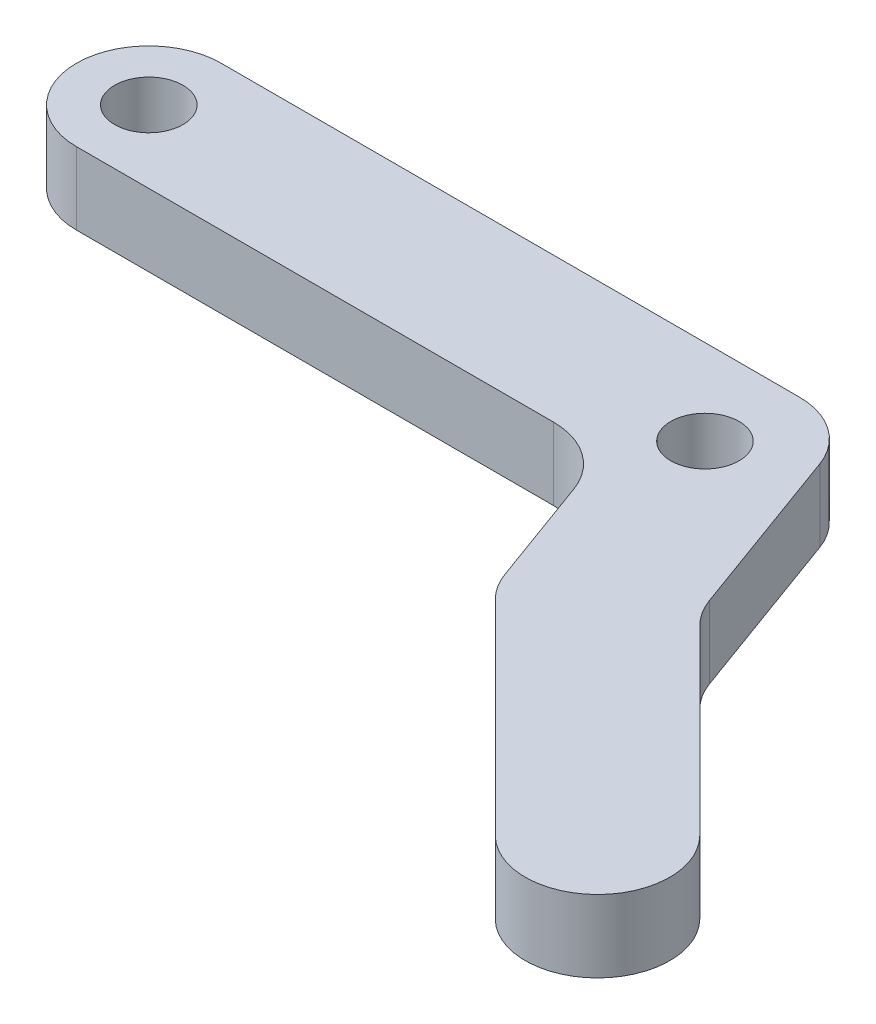
from build123d import *

# Parameters (mm, degrees)
SKETCH1_R           = 1.5
BOSS_EXTRUDE1_DEPTH = 3.175


with BuildPart() as part:
    # Sketch1 → Boss-Extrude1 (new body)
    with BuildSketch(Plane(origin=(0, 0, 0), x_dir=(1, 0, 0), z_dir=(0, 1, 0))):
        with BuildLine():
            Line((0, -3.175), (20.953682132, -3.175))
            ThreePointArc((20.953682132, -3.175), (22.774787318, -3.749192259), (23.937206203, -5.264086045))
            Line((23.937206203, -5.264086045), (25.674217794, -10.036486168))
            ThreePointArc((25.674217794, -10.036486168), (25.979974025, -10.656498469), (26.412677835, -11.195636243))
            Line((26.412677835, -11.195636243), (35.392933956, -20.175892364))
            ThreePointArc((35.392933956, -20.175892364), (39.883062017, -20.175892364), (39.883062017, -15.685764304))
            Line((39.883062017, -15.685764304), (31.898243321, -7.700945608))
            ThreePointArc((31.898243321, -7.700945608), (31.465539511, -7.161807835), (31.15978328, -6.541795533))
            Line((31.15978328, -6.541795533), (28.383524071, 1.085913955))
            ThreePointArc((28.383524071, 1.085913955), (27.221105185, 2.600807741), (25.4, 3.175))
            Line((25.4, 3.175), (0, 3.175))
            ThreePointArc((0, 3.175), (-3.175, 0), (0, -3.175))
        make_face()
        with Locations(Location((24.997946252, -0.574192259, 0), (0, 0, 270))):
            Circle(SKETCH1_R, mode=Mode.SUBTRACT)
        with Locations(Location((0, 0, 0), (0, 0, 270))):
            Circle(SKETCH1_R, mode=Mode.SUBTRACT)
    extrude(amount=BOSS_EXTRUDE1_DEPTH)


solid = part.part
